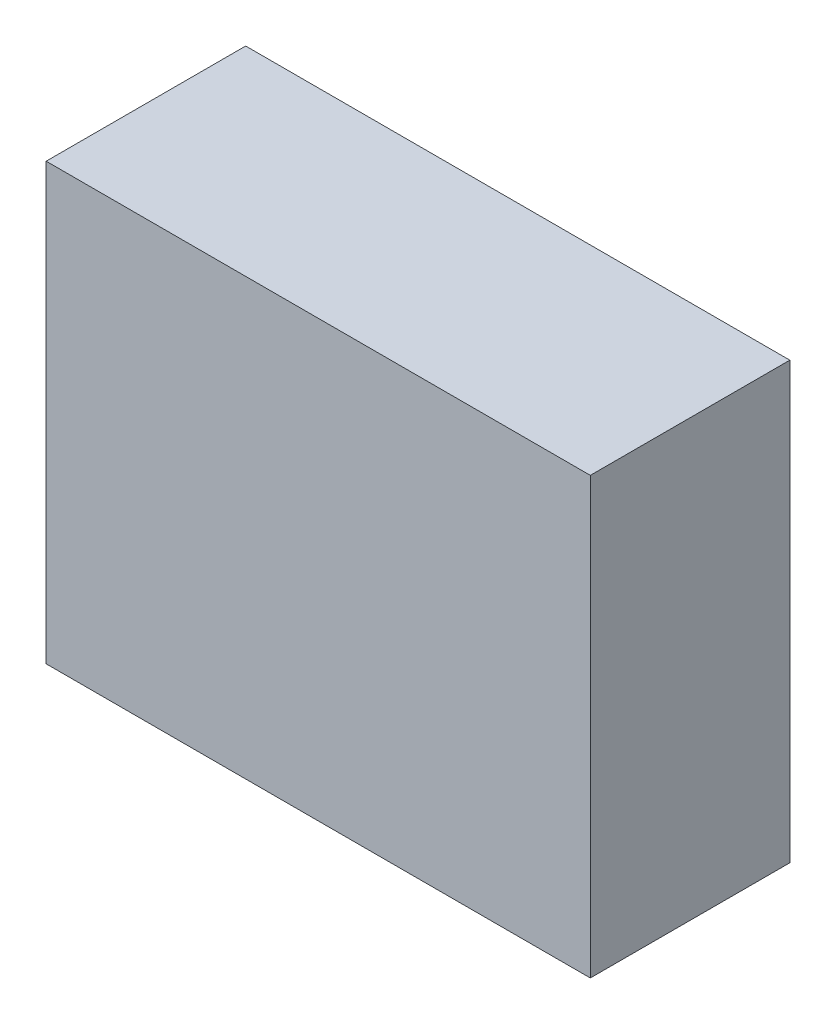
from build123d import *

# Parameters (mm, degrees)
SKETCH2_W              = 30
SKETCH2_H              = 24
REFERENCE_COUPON_DEPTH = 11


with BuildPart() as part:
    # Sketch2 → Reference_coupon (new body)
    with BuildSketch(Plane.XY):
        Rectangle(SKETCH2_W, SKETCH2_H)
    extrude(amount=REFERENCE_COUPON_DEPTH)


solid = part.part
